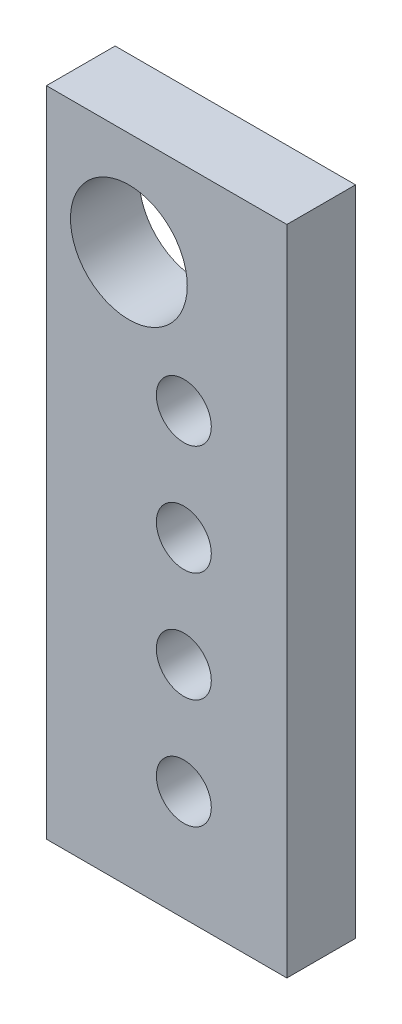
from build123d import *

# Parameters (mm, degrees)
CROQUIS1_W              = 24
CROQUIS1_H              = 47.5
CROQUIS1_R              = 2
CROQUIS1_R_2            = 4.25
SALIENTE_EXTRUIR1_DEPTH = 5
CORTAR_EXTRUIR2_DEPTH   = 5


with BuildPart() as part:
    # Croquis1 → Saliente-Extruir1 (new body)
    with BuildSketch(Plane.XY):
        with Locations((0, -16.25)):
            Rectangle(CROQUIS1_W, CROQUIS1_H)
        with Locations((4.5, -8)):
            Circle(CROQUIS1_R, mode=Mode.SUBTRACT)
        with Locations((4.5, -16)):
            Circle(CROQUIS1_R, mode=Mode.SUBTRACT)
        with Locations((4.5, -24)):
            Circle(CROQUIS1_R, mode=Mode.SUBTRACT)
        with Locations((0.5, 0)):
            Circle(CROQUIS1_R_2, mode=Mode.SUBTRACT)
        with Locations((4.5, -32)):
            Circle(CROQUIS1_R, mode=Mode.SUBTRACT)
    extrude(amount=SALIENTE_EXTRUIR1_DEPTH)

    # Croquis2 → Cortar-Extruir2 (cut)
    with BuildSketch(Plane(origin=(0, 0, 0), x_dir=(-1, 0, 0), z_dir=(0, 0, -1))):
        Polygon((5.5, 7.5), (12, 7.5), (12, -43.69397747), (5.5, -43.69397747), (5.5, -29.215049773), align=None)
    extrude(amount=-CORTAR_EXTRUIR2_DEPTH, mode=Mode.SUBTRACT)


solid = part.part
